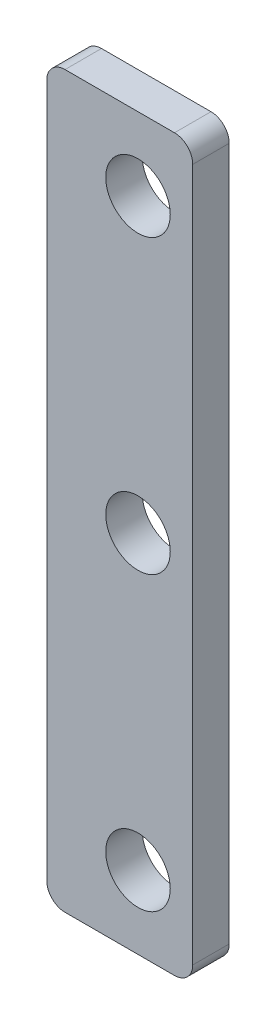
from build123d import *

# Parameters (mm, degrees)
SKETCH1_W                  = 12.7
SKETCH1_H                  = 63.5
BOSS_EXTRUDE1_DEPTH        = 3.175
F_10_CLEARANCE_HOLE1_D     = 5.6134
F_10_CLEARANCE_HOLE1_DEPTH = 25.4
F_10_CLEARANCE_HOLE1_TIP   = 1.686435499
FILLET1_R                  = 1.5875


with BuildPart() as part:
    # Sketch1 → Boss-Extrude1 (new body)
    with BuildSketch(Plane.XY):
        Rectangle(SKETCH1_W, SKETCH1_H)
    extrude(amount=BOSS_EXTRUDE1_DEPTH)

    # #10 Clearance Hole1
    with Locations(Plane.XY.offset(3.175)):
        with Locations((1.5875, -25.4), (1.5875, 0), (1.5875, 25.4)):
            Hole(F_10_CLEARANCE_HOLE1_D / 2, depth=F_10_CLEARANCE_HOLE1_DEPTH)
            with Locations((0, 0, -(F_10_CLEARANCE_HOLE1_DEPTH + F_10_CLEARANCE_HOLE1_TIP / 2))):  # 118° drill point
                Cone(0, F_10_CLEARANCE_HOLE1_D / 2, F_10_CLEARANCE_HOLE1_TIP, mode=Mode.SUBTRACT)

    # Fillet1
    fillet1_edges = [part.edges().sort_by_distance(p)[0] for p in [
        (6.35, -31.75, 1.5875),
        (-6.35, -31.75, 1.5875),
        (-6.35, 31.75, 1.5875),
        (6.35, 31.75, 1.5875),
    ]]
    fillet(fillet1_edges, radius=FILLET1_R)


solid = part.part
